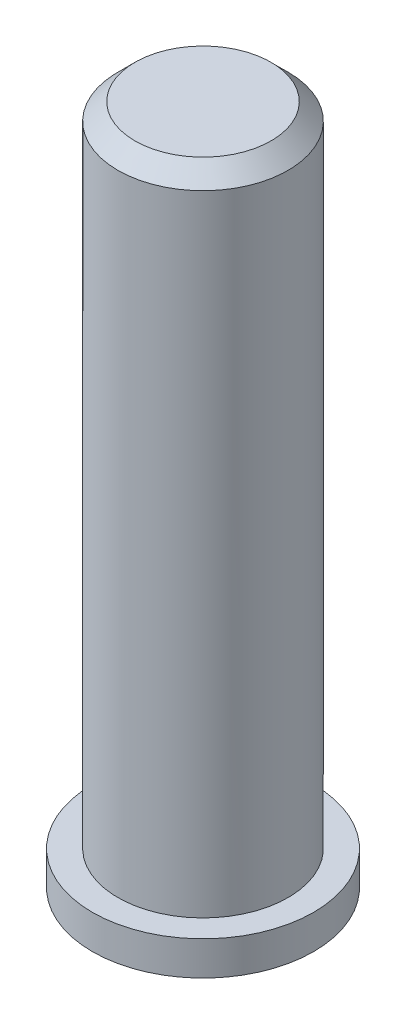
from build123d import *

# Parameters (mm, degrees)
SKETCH_1_R      = 2.5
EXTRUDE_1_DEPTH = 20
CHAMFER_1_SIZE  = 0.5
SKETCH_2_R      = 3.25
EXTRUDE_2_DEPTH = 1
SKETCH_3_R      = 0.375
EXTRUDE_3_DEPTH = 0.8


with BuildPart() as part:
    # Эскиз1 → Вытянуть1 (new body)
    with BuildSketch(Plane(origin=(0, 0, 0), x_dir=(1, 0, 0), z_dir=(0, 1, 0))):
        with Locations(Location((0, 0, 0), (0, 0, 270))):
            Circle(SKETCH_1_R)
    extrude(amount=EXTRUDE_1_DEPTH)

    # Фаска1
    chamfer_1_edges = [part.edges().sort_by_distance(p)[0] for p in [
        (0, 20, -2.5),
    ]]
    chamfer(chamfer_1_edges, length=CHAMFER_1_SIZE)

    # Эскиз2 → Вытянуть2 (add)
    with BuildSketch(Plane.XZ):
        with Locations(Location((0, 0, 0), (0, 0, 270))):
            Circle(SKETCH_2_R)
    extrude(amount=-EXTRUDE_2_DEPTH)

    # Эскиз3 → Вытянуть3 (add)
    with BuildSketch(Plane.XZ):
        with Locations(Location((0, 0, 0), (0, 0, 90))):
            Circle(SKETCH_3_R)
    extrude(amount=EXTRUDE_3_DEPTH)


solid = part.part
